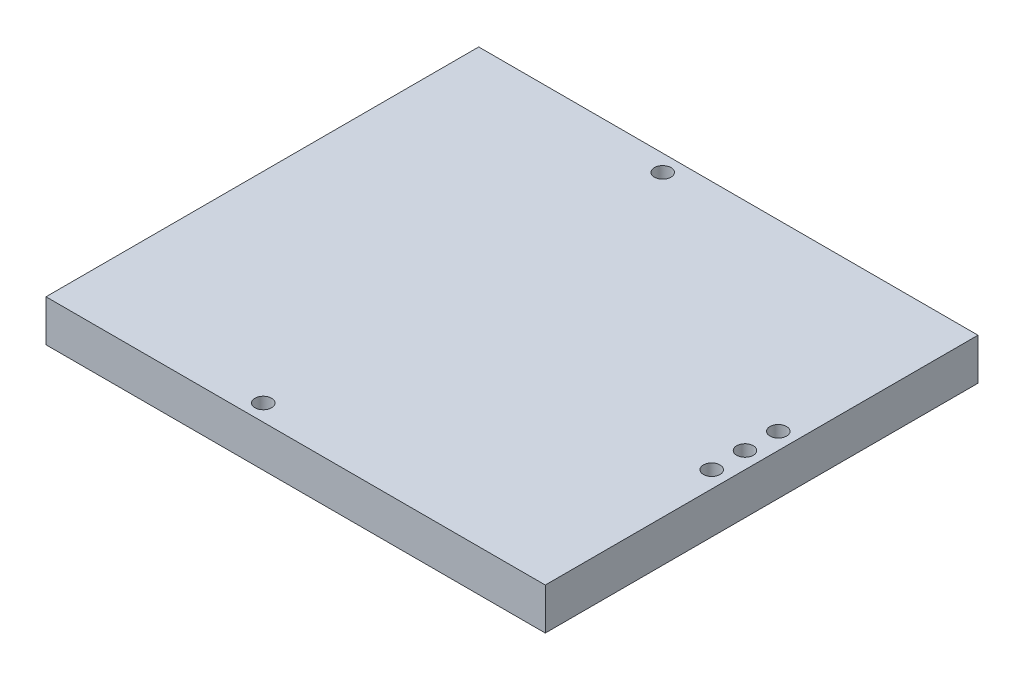
from build123d import *

# Parameters (mm, degrees)
SKETCH1_W           = 120
SKETCH1_H           = 104
SKETCH1_R           = 2
BOSS_EXTRUDE2_DEPTH = 10


with BuildPart() as part:
    # Sketch1 → Boss-Extrude2 (new body)
    with BuildSketch(Plane(origin=(0, 0, 0), x_dir=(1, 0, 0), z_dir=(0, 1, 0))):
        with Locations((60, 52)):
            Rectangle(SKETCH1_W, SKETCH1_H)
        with Locations(Location((116, 52, 0), (0, 0, 270))):
            Circle(SKETCH1_R, mode=Mode.SUBTRACT)
        with Locations(Location((116, 60, 0), (0, 0, 270))):
            Circle(SKETCH1_R, mode=Mode.SUBTRACT)
        with Locations(Location((116, 44, 0), (0, 0, 90))):
            Circle(SKETCH1_R, mode=Mode.SUBTRACT)
        with Locations(Location((48.223234069, 4, 0), (0, 0, 270))):
            Circle(SKETCH1_R, mode=Mode.SUBTRACT)
        with Locations(Location((48.223234069, 100, 0), (0, 0, 90))):
            Circle(SKETCH1_R, mode=Mode.SUBTRACT)
    extrude(amount=BOSS_EXTRUDE2_DEPTH)


solid = part.part
